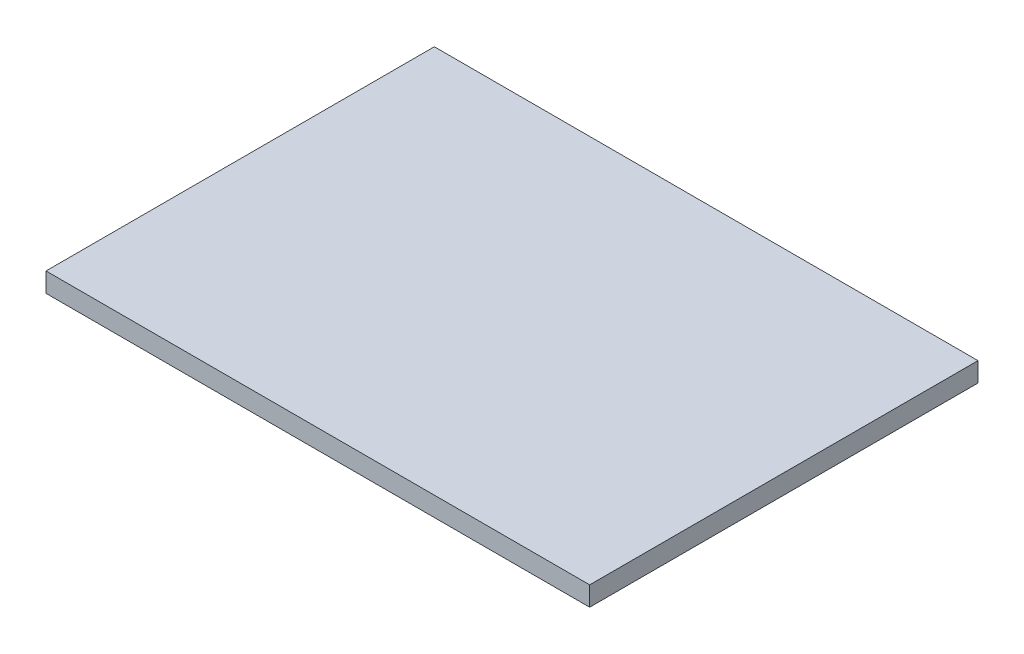
from build123d import *

# Parameters (mm, degrees)
SKETCH_1_W      = 140
SKETCH_1_H      = 100
EXTRUDE_1_DEPTH = 5


with BuildPart() as part:
    # 草图1 → 凸台-拉伸1 (new body)
    with BuildSketch(Plane(origin=(0, 0, 0), x_dir=(1, 0, 0), z_dir=(0, 1, 0))):
        Rectangle(SKETCH_1_W, SKETCH_1_H)
    extrude(amount=EXTRUDE_1_DEPTH)


solid = part.part
